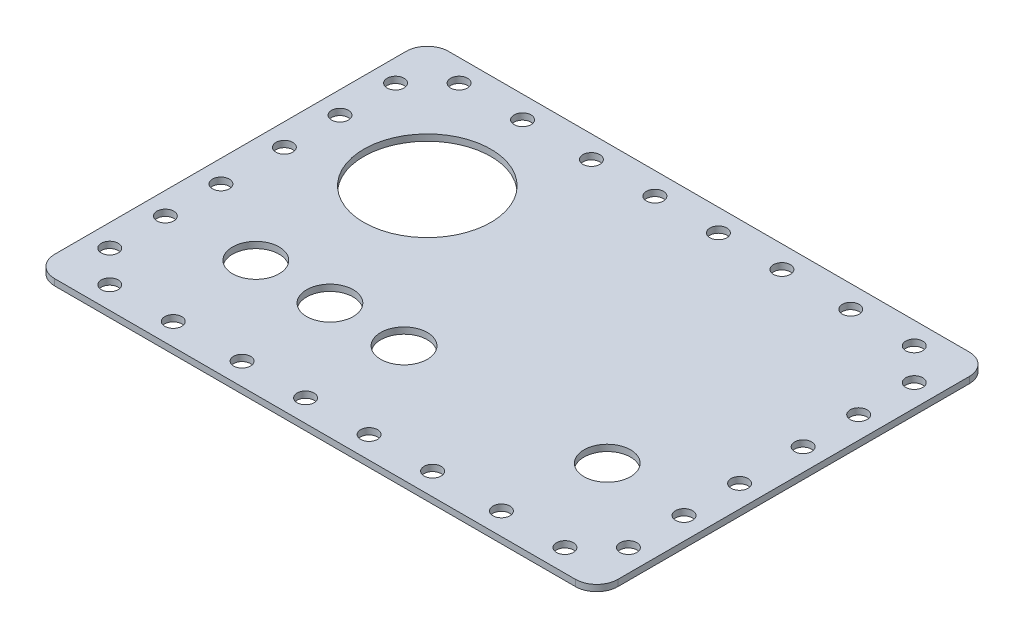
from build123d import *

# Parameters (mm, degrees)
SKETCH1_W           = 266
SKETCH1_H           = 186
BOSS_EXTRUDE1_DEPTH = 3
FILLET1_R           = 10
SKETCH2_R           = 4
SKETCH2_R_2         = 30
SKETCH2_R_3         = 11
CUT_EXTRUDE1_DEPTH  = 163.317589928


with BuildPart() as part:
    # Sketch1 → Boss-Extrude1 (new body)
    with BuildSketch(Plane(origin=(0, 0, 0), x_dir=(1, 0, 0), z_dir=(0, 1, 0))):
        Rectangle(SKETCH1_W, SKETCH1_H)
    extrude(amount=BOSS_EXTRUDE1_DEPTH)

    # Fillet1
    fillet1_edges = [part.edges().sort_by_distance(p)[0] for p in [
        (-133, 1.5, -93),
        (133, 1.5, -93),
        (133, 1.5, 93),
        (-133, 1.5, 93),
    ]]
    fillet(fillet1_edges, radius=FILLET1_R)

    # Sketch2 → Cut-Extrude1 (cut, through all)
    with BuildSketch(Plane(origin=(0, 3, 0), x_dir=(1, 0, 0), z_dir=(0, 1, 0))):
        with Locations(Location((-122.5, -15, 0), (0, 0, 270))):
            Circle(SKETCH2_R)
        with Locations(Location((-122.5, -41.25, 0), (0, 0, 270))):
            Circle(SKETCH2_R)
        with Locations(Location((-122.5, -67.5, 0), (0, 0, 270))):
            Circle(SKETCH2_R)
        with Locations(Location((-107.5, -82.5, 0), (0, 0, 270))):
            Circle(SKETCH2_R)
        with Locations(Location((-77.5, -82.5, 0), (0, 0, 270))):
            Circle(SKETCH2_R)
        with Locations(Location((-45, -82.5, 0), (0, 0, 270))):
            Circle(SKETCH2_R)
        with Locations(Location((-15, -82.5, 0), (0, 0, 270))):
            Circle(SKETCH2_R)
        with Locations(Location((-15, 82.5, 0), (0, 0, 90))):
            Circle(SKETCH2_R)
        with Locations(Location((-45, 82.5, 0), (0, 0, 90))):
            Circle(SKETCH2_R)
        with Locations(Location((-77.5, 82.5, 0), (0, 0, 90))):
            Circle(SKETCH2_R)
        with Locations(Location((-107.5, 82.5, 0), (0, 0, 90))):
            Circle(SKETCH2_R)
        with Locations(Location((-122.5, 67.5, 0), (0, 0, 90))):
            Circle(SKETCH2_R)
        with Locations(Location((-122.5, 41.25, 0), (0, 0, 90))):
            Circle(SKETCH2_R)
        with Locations(Location((-122.5, 15, 0), (0, 0, 90))):
            Circle(SKETCH2_R)
        with Locations(Location((15, -82.5, 0), (0, 0, 90))):
            Circle(SKETCH2_R)
        with Locations(Location((107.5, -82.5, 0), (0, 0, 90))):
            Circle(SKETCH2_R)
        with Locations(Location((122.5, -67.5, 0), (0, 0, 90))):
            Circle(SKETCH2_R)
        with Locations(Location((122.5, -41.25, 0), (0, 0, 90))):
            Circle(SKETCH2_R)
        with Locations(Location((122.5, -15, 0), (0, 0, 90))):
            Circle(SKETCH2_R)
        with Locations(Location((122.5, 15, 0), (0, 0, 270))):
            Circle(SKETCH2_R)
        with Locations(Location((122.5, 41.25, 0), (0, 0, 270))):
            Circle(SKETCH2_R)
        with Locations(Location((122.5, 67.5, 0), (0, 0, 270))):
            Circle(SKETCH2_R)
        with Locations(Location((107.5, 82.5, 0), (0, 0, 270))):
            Circle(SKETCH2_R)
        with Locations(Location((77.5, 82.5, 0), (0, 0, 270))):
            Circle(SKETCH2_R)
        with Locations(Location((45, 82.5, 0), (0, 0, 270))):
            Circle(SKETCH2_R)
        with Locations(Location((15, 82.5, 0), (0, 0, 270))):
            Circle(SKETCH2_R)
        with Locations(Location((-73, 33, 0), (0, 0, 270))):
            Circle(SKETCH2_R_2)
        with Locations(Location((83, -38, 0), (0, 0, 270))):
            Circle(SKETCH2_R_3)
        with Locations(Location((-83, -38, 0), (0, 0, 270))):
            Circle(SKETCH2_R_3)
        with Locations(Location((-48, -38, 0), (0, 0, 270))):
            Circle(SKETCH2_R_3)
        with Locations(Location((-13, -38, 0), (0, 0, 270))):
            Circle(SKETCH2_R_3)
        with Locations(Location((45, -82.5, 0), (0, 0, 90))):
            Circle(SKETCH2_R)
        with Locations(Location((77.5, -82.5, 0), (0, 0, 90))):
            Circle(SKETCH2_R)
    extrude(amount=-CUT_EXTRUDE1_DEPTH, mode=Mode.SUBTRACT)


solid = part.part
